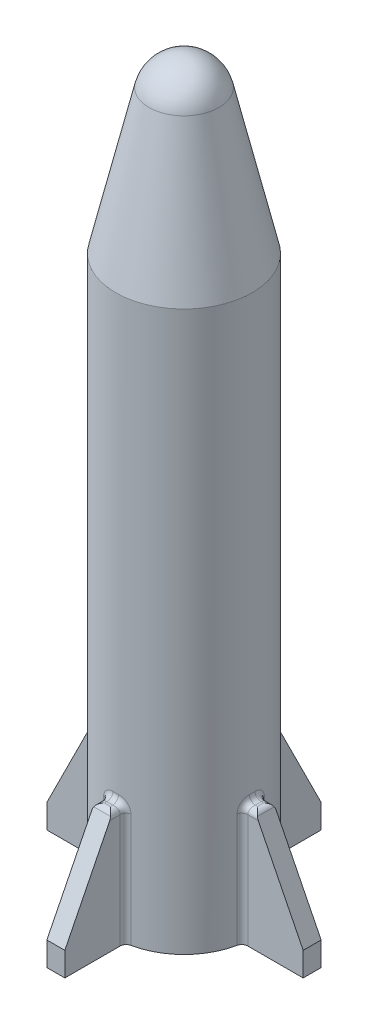
from build123d import *

# Parameters (mm, degrees)
SHELL1_T                 = -1
BOSS_EXTRUDE2_REACH      = 69.317
BOSS_EXTRUDE2_END_RADIUS = 5.7
BOSS_EXTRUDE2_START      = 5
SKETCH4_W                = 1.5
SKETCH4_H                = 10
CUT_EXTRUDE1_DEPTH       = 1.5
CIRPATTERN1_COUNT        = 4
FILLET1_R                = 0.5


with BuildPart() as part:
    # Sketch2 → Revolve1 (revolve)
    with BuildSketch(Plane.XY, mode=Mode.PRIVATE) as revolve1_sk:
        with BuildLine():
            Line((0, 46.676434016), (-2.777255225, 58.676434016))
            ThreePointArc((-2.777255225, 58.676434016), (-3.833091064, 60.348329411), (-5.7, 61))
            Line((-5.7, 61), (-5.7, 58))
            Line((-5.7, 58), (-5.7, 0))
            Line((-5.7, 0), (0, 0))
            Line((0, 0), (0, 46.676434016))
        make_face()
    revolve(revolve1_sk.sketch.rotate(Axis((-5.7, 58, 0), (0, -1, 0)), 90), axis=Axis((-5.7, 58, 0), (0, -1, 0)))

    # Shell1
    shell1_openings = [part.faces().sort_by_distance(p)[0] for p in [
        (-5.7, 0, 0),
    ]]
    offset(amount=SHELL1_T, openings=shell1_openings, kind=Kind.INTERSECTION)

    # Boss-Extrude2: up to this cylinder (the profile starts outside it)
    boss_extrude2_end = Plane(origin=(-5.7, 5, 0), z_dir=(0, 1, 0)) * Cylinder(BOSS_EXTRUDE2_END_RADIUS, 151.034, mode=Mode.PRIVATE)
    # Sketch4 → Boss-Extrude2 (add, up to the surface)
    with BuildSketch(Plane(origin=(0, 0, 0), x_dir=(0, 0, -1), z_dir=(1, 0, 0)).offset(BOSS_EXTRUDE2_START), mode=Mode.PRIVATE) as boss_extrude2_sk1:
        with Locations((0, 5)):
            Rectangle(SKETCH4_W, SKETCH4_H)
    boss_extrude2_tool1 = extrude(boss_extrude2_sk1.sketch, amount=-BOSS_EXTRUDE2_REACH, mode=Mode.PRIVATE) - boss_extrude2_end
    boss_extrude2 = boss_extrude2_tool1.solids().sort_by_distance((5, 5, 0))[0]
    add(boss_extrude2)

    # Sketch5 → Cut-Extrude1 (cut)
    with BuildSketch(Plane.XY.offset(0.75)):
        Polygon((1, 10), (5, 2), (5, 10), align=None)
    cut_extrude1 = extrude(amount=-CUT_EXTRUDE1_DEPTH, mode=Mode.SUBTRACT)

    # CirPattern1: Boss-Extrude2, Cut-Extrude1 ×4 about axis
    cirpattern1_axis = Axis((-5.7, 0, 0), (0, 1, 0))
    add([boss_extrude2.rotate(cirpattern1_axis, i * 360 / CIRPATTERN1_COUNT) for i in range(1, CIRPATTERN1_COUNT)])
    add([cut_extrude1.rotate(cirpattern1_axis, i * 360 / CIRPATTERN1_COUNT) for i in range(1, CIRPATTERN1_COUNT)], mode=Mode.SUBTRACT)

    # Fillet1
    fillet1_edges = [part.edges().sort_by_distance(p)[0] for p in [
        (-0.049557539, 5, -0.75),
        (0.47522123, 10, -0.75),
        (0, 10, 0),
        (0.47522123, 10, 0.75),
        (-0.049557539, 5, 0.75),
        (1, 10, 0),
        (-6.45, 5, -5.650442461),
        (-6.45, 10, -6.17522123),
        (-5.7, 10, -5.7),
        (-4.95, 10, -6.17522123),
        (-4.95, 5, -5.650442461),
        (-11.350442461, 5, 0.75),
        (-11.87522123, 10, 0.75),
        (-11.4, 10, 0),
        (-11.87522123, 10, -0.75),
        (-11.350442461, 5, -0.75),
        (-6.45, 5, 5.650442461),
        (-5.324182242, 10, 5.687597121),
        (-6.45, 10, 6.17522123),
        (-4.95, 5, 5.650442461),
        (-4.95, 10, 6.17522123),
        (-5.7, 10, -6.7),
        (-12.4, 10, 0),
        (-5.7, 10, 6.7),
    ]]
    fillet(fillet1_edges, radius=FILLET1_R)


solid = part.part
